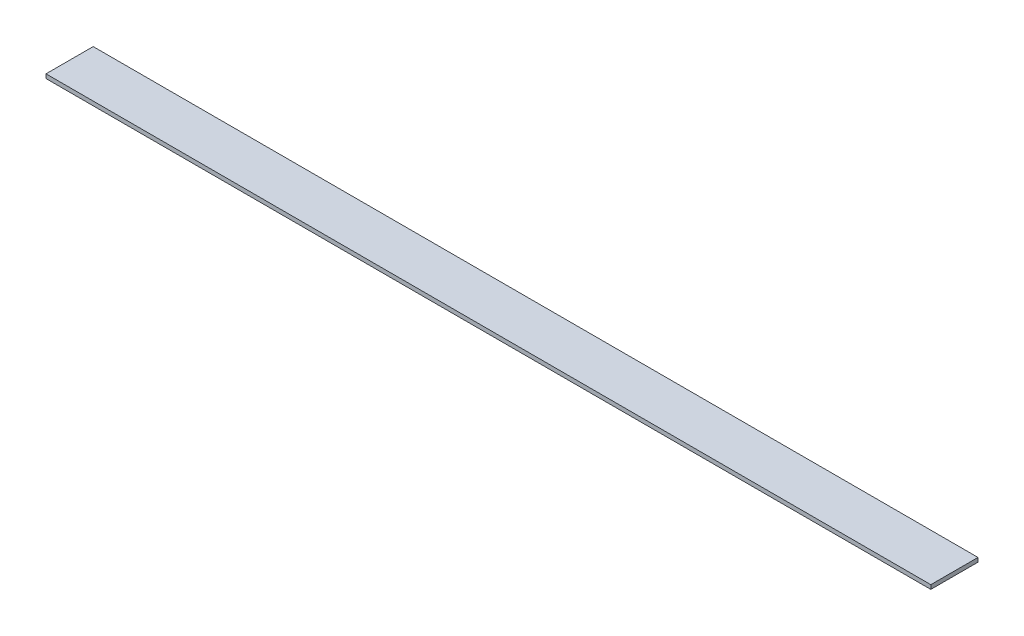
from build123d import *

# Parameters (mm, degrees)
SKIZZE1_W                       = 1500
SKIZZE1_H                       = 80
AUFSATZ_LINEAR_AUSTRAGEN1_DEPTH = 7


with BuildPart() as part:
    # Skizze1 → Aufsatz-Linear austragen1 (new body)
    with BuildSketch(Plane(origin=(0, 0, 0), x_dir=(1, 0, 0), z_dir=(0, 1, 0))):
        Rectangle(SKIZZE1_W, SKIZZE1_H)
    extrude(amount=AUFSATZ_LINEAR_AUSTRAGEN1_DEPTH)


solid = part.part
